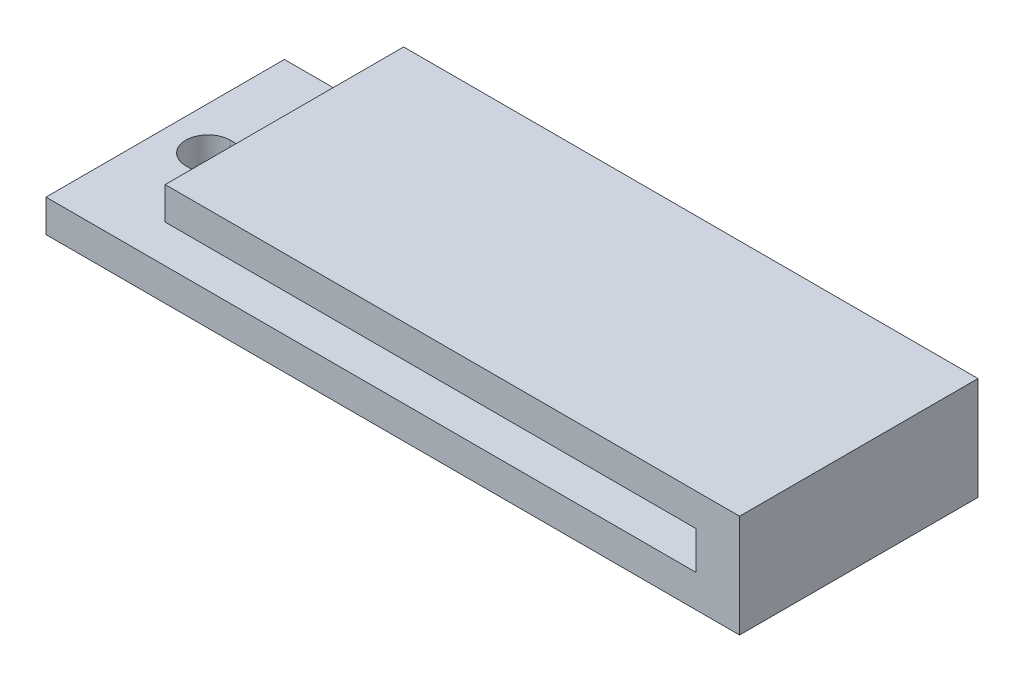
from build123d import *

# Parameters (mm, degrees)
SKETCH1_W           = 49
SKETCH1_H           = 22
BOSS_EXTRUDE1_DEPTH = 3
BOSS_EXTRUDE2_DEPTH = 22
BOSS_EXTRUDE3_DEPTH = 3
CUT_EXTRUDE1_DEPTH  = 3


with BuildPart() as part:
    # Sketch1 → Boss-Extrude1 (new body)
    with BuildSketch(Plane(origin=(0, 0, 0), x_dir=(1, 0, 0), z_dir=(0, 1, 0))):
        with Locations((-24.5, 11)):
            Rectangle(SKETCH1_W, SKETCH1_H)
    extrude(amount=BOSS_EXTRUDE1_DEPTH)

    # Sketch2 → Boss-Extrude2 (add)
    with BuildSketch(Plane.XY):
        Polygon((0, 0), (0, -3.5), (4, -3.5), (4, 3), (0, 3), align=None)
    extrude(amount=-BOSS_EXTRUDE2_DEPTH)

    # Sketch3 → Boss-Extrude3 (add)
    with BuildSketch(Plane.XZ.offset(3.5)):
        Polygon((0, 0), (-60, 0), (-60, -22), (0, -22), (4, -22), (4, 0), align=None)
    extrude(amount=BOSS_EXTRUDE3_DEPTH)

    # Sketch4 → Cut-Extrude1 (cut)
    with BuildSketch(Plane.XZ.offset(6.5)):
        with BuildLine():
            Line((-56.05, -8.95), (-54, -8.95))
            ThreePointArc((-54, -8.95), (-51.95, -11), (-54, -13.05))
            Line((-54, -13.05), (-56.05, -13.05))
            ThreePointArc((-56.05, -13.05), (-58.1, -11), (-56.05, -8.95))
        make_face()
    extrude(amount=-CUT_EXTRUDE1_DEPTH, mode=Mode.SUBTRACT)


solid = part.part
